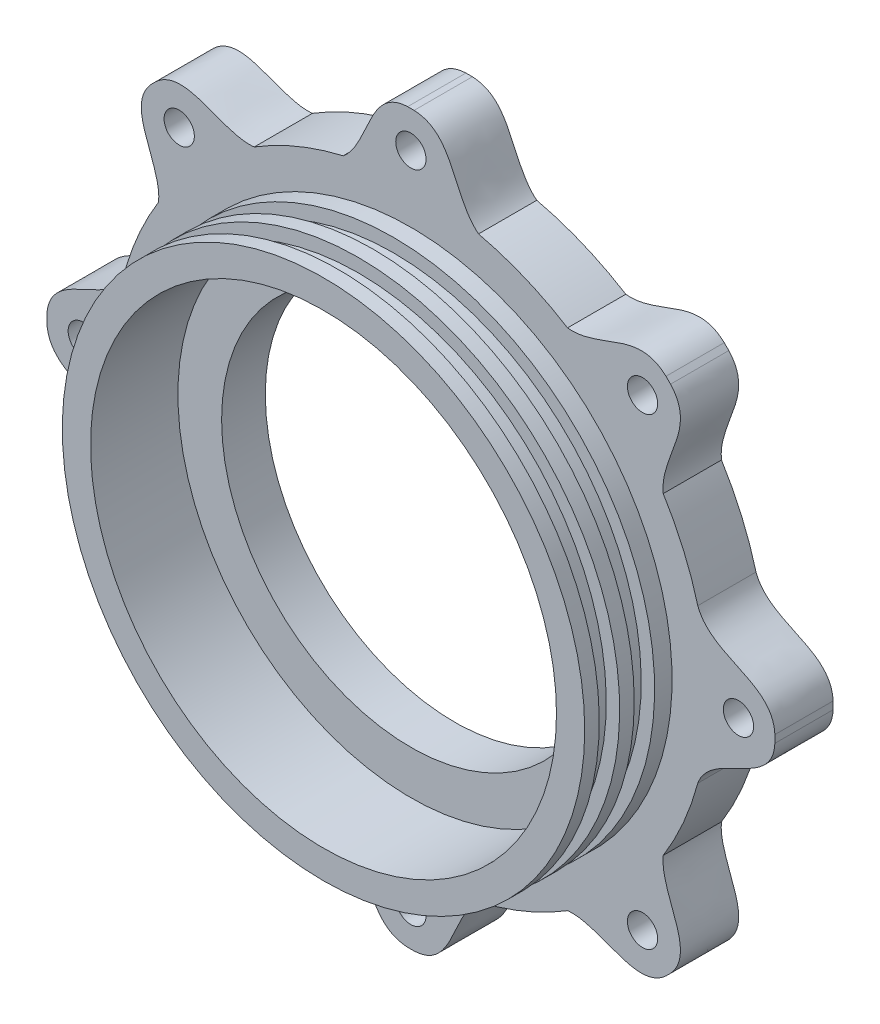
from build123d import *

# Parameters (mm, degrees)
SKETCH1_R           = 44.85
BOSS_EXTRUDE1_DEPTH = 15
SKETCH2_R           = 62.5
BOSS_EXTRUDE2_DEPTH = 10
SKETCH3_R           = 40
CUT_EXTRUDE1_DEPTH  = 15
SKETCH4_W           = 3.5
SKETCH4_H           = 3.724799257
SKETCH7_R           = 2.6
CUT_EXTRUDE4_DEPTH  = 92.855865354
CIRPATTERN1_COUNT   = 8
SKETCH9_R           = 37.5
CUT_EXTRUDE6_DEPTH  = 2.5
SKETCH10_R          = 32.5
CUT_EXTRUDE7_DEPTH  = 92.207181735
SKETCH16_R          = 63
CUT_EXTRUDE12_DEPTH = 10


with BuildPart() as part:
    # Sketch1 → Boss-Extrude1 (new body)
    with BuildSketch(Plane.XY):
        Circle(SKETCH1_R)
    extrude(amount=BOSS_EXTRUDE1_DEPTH)

    # Sketch2 → Boss-Extrude2 (add)
    with BuildSketch(Plane(origin=(0, 0, 0), x_dir=(-1, 0, 0), z_dir=(0, 0, -1))):
        Circle(SKETCH2_R)
    extrude(amount=BOSS_EXTRUDE2_DEPTH)

    # Sketch3 → Cut-Extrude1 (cut)
    with BuildSketch(Plane.XY.offset(15)):
        Circle(SKETCH3_R)
    extrude(amount=-CUT_EXTRUDE1_DEPTH, mode=Mode.SUBTRACT)

    # Sketch4 → Cut-Revolve1 (revolve, cut)
    with BuildSketch(Plane(origin=(0, 0, 0), x_dir=(0, 0, -1), z_dir=(1, 0, 0))):
        with Locations((-4.75, 44.412399629)):
            Rectangle(SKETCH4_W, SKETCH4_H)
        with Locations((-10.75, 44.412399629)):
            Rectangle(SKETCH4_W, SKETCH4_H)
    revolve(axis=Axis((0, 0, -42.713110189), (0, 0, 1)), mode=Mode.SUBTRACT)

    # Sketch7 → Cut-Extrude4 (cut, through all)
    with BuildSketch(Plane(origin=(0, 0, -10), x_dir=(-1, 0, 0), z_dir=(0, 0, -1))):
        with Locations((56.25, 0)):
            Circle(SKETCH7_R)
    cut_extrude4 = extrude(amount=-CUT_EXTRUDE4_DEPTH, mode=Mode.SUBTRACT)

    # CirPattern1: Cut-Extrude4 ×8 about axis
    cirpattern1_axis = Axis((0, 0, -45.874761596), (0, 0, 1))
    for i in range(1, CIRPATTERN1_COUNT):
        add(cut_extrude4.rotate(cirpattern1_axis, i * 360 / CIRPATTERN1_COUNT), mode=Mode.SUBTRACT)

    # Sketch9 → Cut-Extrude6 (cut)
    with BuildSketch(Plane(origin=(0, 0, -10), x_dir=(-1, 0, 0), z_dir=(0, 0, -1))):
        Circle(SKETCH9_R)
    extrude(amount=-CUT_EXTRUDE6_DEPTH, mode=Mode.SUBTRACT)

    # Sketch10 → Cut-Extrude7 (cut, through all)
    with BuildSketch(Plane(origin=(0, 0, -7.5), x_dir=(-1, 0, 0), z_dir=(0, 0, -1))):
        Circle(SKETCH10_R)
    extrude(amount=-CUT_EXTRUDE7_DEPTH, mode=Mode.SUBTRACT)

    # Sketch16 → Cut-Extrude12 (cut)
    with BuildSketch(Plane.XY):
        Circle(SKETCH16_R)
        with BuildLine():
            ThreePointArc((43.328890761, 26.899948428), (46.799594325, 20.268151644), (49.262217141, 13.1997713))
            add(Edge.make_bspline(
                [(62.5, 0), (62.770955577, 8.083006491), (51.628518063, 6.724329941), (49.262217141, 13.1997713)],
                knots=[0, 0, 0, 0, 1, 1, 1, 1], degree=3))
            add(Edge.make_bspline(
                [(62.5, 0), (62.770955577, -8.083006491), (51.628518063, -6.724329941), (49.262217141, -13.1997713)],
                knots=[0, 0, 0, 0, 1, 1, 1, 1], degree=3))
            ThreePointArc((49.262217141, -13.1997713), (46.799594325, -20.268151644), (43.328890761, -26.899948428))
            add(Edge.make_bspline(
                [(44.194173824, -44.194173824), (49.607706082, -39.076201353), (42.687983273, -32.734064805), (43.328890761, -26.899948428)],
                knots=[0, 0, 0, 0, 0.913122258, 0.913122258, 0.913122258, 0.913122258], degree=3))
            add(Edge.make_bspline(
                [(44.194173824, -44.194173824), (39.076201353, -49.607706082), (32.734064805, -42.687983273), (26.899948428, -43.328890761)],
                knots=[0, 0, 0, 0, 0.913122258, 0.913122258, 0.913122258, 0.913122258], degree=3))
            ThreePointArc((26.899948428, -43.328890761), (19.516855051, -47.117856158), (11.617016531, -49.659288425))
            add(Edge.make_bspline(
                [(0, -62.5), (7.44689841, -62.708992329), (7.038483248, -53.331441647), (11.617016531, -49.659288425)],
                knots=[0, 0, 0, 0, 0.913122258, 0.913122258, 0.913122258, 0.913122258], degree=3))
            add(Edge.make_bspline(
                [(0, -62.5), (-7.44689841, -62.708992329), (-7.038483248, -53.331441647), (-11.617016531, -49.659288425)],
                knots=[0, 0, 0, 0, 0.913122258, 0.913122258, 0.913122258, 0.913122258], degree=3))
            ThreePointArc((-11.617016531, -49.659288425), (-19.516855051, -47.117856158), (-26.899948428, -43.328890761))
            add(Edge.make_bspline(
                [(-44.194173824, -44.194173824), (-39.076201353, -49.607706082), (-32.734064805, -42.687983273), (-26.899948428, -43.328890761)],
                knots=[0, 0, 0, 0, 0.913122258, 0.913122258, 0.913122258, 0.913122258], degree=3))
            add(Edge.make_bspline(
                [(-44.194173824, -44.194173824), (-49.607706082, -39.076201353), (-42.687983273, -32.734064805), (-43.328890761, -26.899948428)],
                knots=[0, 0, 0, 0, 0.913122258, 0.913122258, 0.913122258, 0.913122258], degree=3))
            ThreePointArc((-43.328890761, -26.899948428), (-47.117856158, -19.516855051), (-49.659288425, -11.617016531))
            add(Edge.make_bspline(
                [(-62.5, 0), (-62.708992329, -7.44689841), (-53.331441647, -7.038483248), (-49.659288425, -11.617016531)],
                knots=[0, 0, 0, 0, 0.913122258, 0.913122258, 0.913122258, 0.913122258], degree=3))
            add(Edge.make_bspline(
                [(-62.5, 0), (-62.708992329, 7.44689841), (-53.331441647, 7.038483248), (-49.659288425, 11.617016531)],
                knots=[0, 0, 0, 0, 0.913122258, 0.913122258, 0.913122258, 0.913122258], degree=3))
            ThreePointArc((-49.659288425, 11.617016531), (-47.117856158, 19.516855051), (-43.328890761, 26.899948428))
            add(Edge.make_bspline(
                [(-44.194173824, 44.194173824), (-49.607706082, 39.076201353), (-42.687983273, 32.734064805), (-43.328890761, 26.899948428)],
                knots=[0, 0, 0, 0, 0.913122258, 0.913122258, 0.913122258, 0.913122258], degree=3))
            add(Edge.make_bspline(
                [(-44.194173824, 44.194173824), (-39.076201353, 49.607706082), (-32.734064805, 42.687983273), (-26.899948428, 43.328890761)],
                knots=[0, 0, 0, 0, 0.913122258, 0.913122258, 0.913122258, 0.913122258], degree=3))
            ThreePointArc((-26.899948428, 43.328890761), (-19.516855051, 47.117856158), (-11.617016531, 49.659288425))
            add(Edge.make_bspline(
                [(0, 62.5), (-7.44689841, 62.708992329), (-7.038483248, 53.331441647), (-11.617016531, 49.659288425)],
                knots=[0, 0, 0, 0, 0.913122258, 0.913122258, 0.913122258, 0.913122258], degree=3))
            add(Edge.make_bspline(
                [(0, 62.5), (7.44689841, 62.708992329), (7.038483248, 53.331441647), (11.617016531, 49.659288425)],
                knots=[0, 0, 0, 0, 0.913122258, 0.913122258, 0.913122258, 0.913122258], degree=3))
            ThreePointArc((11.617016531, 49.659288425), (19.516855051, 47.117856158), (26.899948428, 43.328890761))
            add(Edge.make_bspline(
                [(44.194173824, 44.194173824), (39.076201353, 49.607706082), (32.734064805, 42.687983273), (26.899948428, 43.328890761)],
                knots=[0, 0, 0, 0, 0.913122258, 0.913122258, 0.913122258, 0.913122258], degree=3))
            add(Edge.make_bspline(
                [(44.194173824, 44.194173824), (49.607706082, 39.076201353), (42.687983273, 32.734064805), (43.328890761, 26.899948428)],
                knots=[0, 0, 0, 0, 0.913122258, 0.913122258, 0.913122258, 0.913122258], degree=3))
        make_face(mode=Mode.SUBTRACT)
    extrude(amount=-CUT_EXTRUDE12_DEPTH, mode=Mode.SUBTRACT)


solid = part.part
